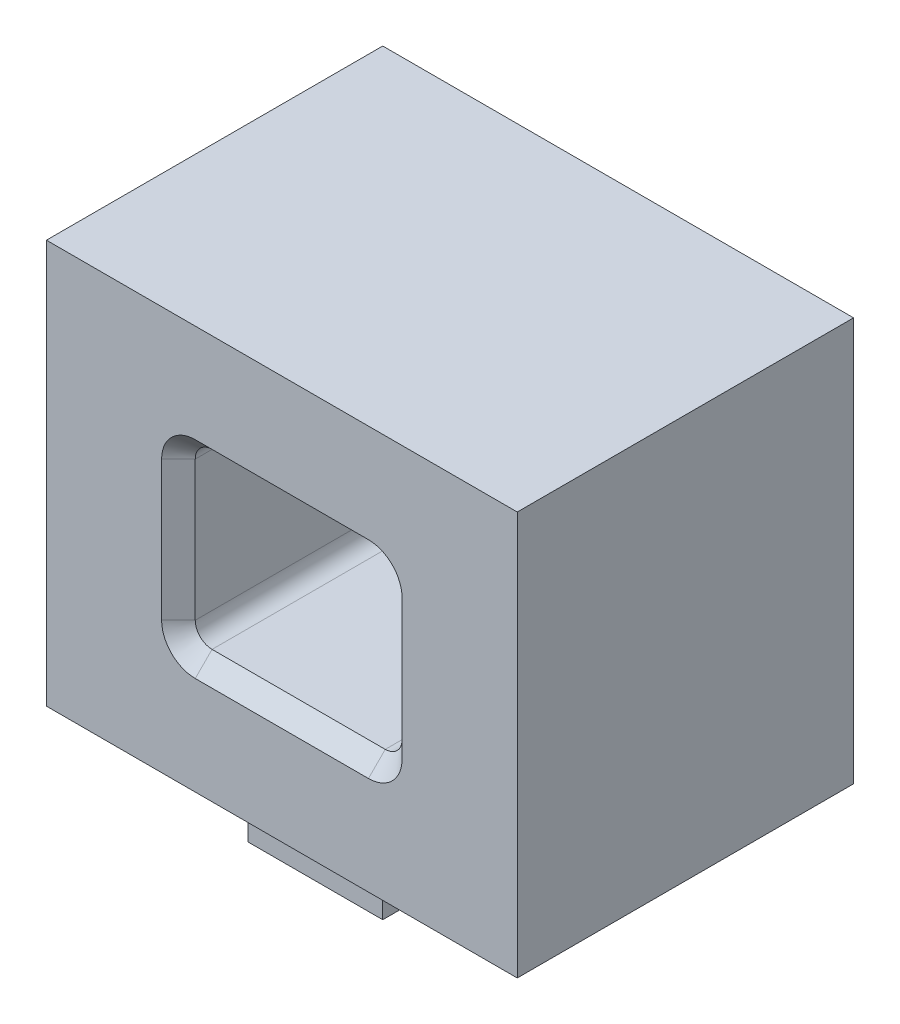
from build123d import *

# Parameters (mm, degrees)
SKETCH1_W           = 28
SKETCH1_H           = 24
BOSS_EXTRUDE1_DEPTH = 20
SKETCH2_W           = 12.3
SKETCH2_H           = 10.3
CUT_EXTRUDE1_DEPTH  = 15.3
SKETCH3_W           = 8
SKETCH3_H           = 6
SKETCH3_R           = 1.7
BOSS_EXTRUDE3_DEPTH = 3
FILLET1_R           = 1
CHAMFER1_SIZE       = 1
FILLET2_R           = 1


with BuildPart() as part:
    # Sketch1 → Boss-Extrude1 (new body)
    with BuildSketch(Plane.XY):
        Rectangle(SKETCH1_W, SKETCH1_H)
    extrude(amount=BOSS_EXTRUDE1_DEPTH)

    # Sketch2 → Cut-Extrude1 (cut)
    with BuildSketch(Plane.XY.offset(20)):
        Rectangle(SKETCH2_W, SKETCH2_H)
    extrude(amount=-CUT_EXTRUDE1_DEPTH, mode=Mode.SUBTRACT)

    # Sketch3 → Boss-Extrude3 (add)
    # profile 1 of 2: a face of its own
    with BuildSketch(Plane.XZ.offset(12)):
        with Locations((0, 5)):
            Rectangle(SKETCH3_W, SKETCH3_H)
        with Locations(Location((0, 5, 0), (0, 0, 90))):
            Circle(SKETCH3_R, mode=Mode.SUBTRACT)
    # profile 2 of 2: a face of its own
    with BuildSketch(Plane.XZ.offset(12)):
        with Locations((0, 15)):
            Rectangle(SKETCH3_W, SKETCH3_H)
        with Locations(Location((0, 15, 0), (0, 0, 270))):
            Circle(SKETCH3_R, mode=Mode.SUBTRACT)
    extrude(amount=BOSS_EXTRUDE3_DEPTH)

    # Fillet1
    fillet1_edges = [part.edges().sort_by_distance(p)[0] for p in [
        (-6.15, 5.15, 12.35),
        (6.15, 5.15, 12.35),
        (6.15, -5.15, 12.35),
        (-6.15, -5.15, 12.35),
    ]]
    fillet(fillet1_edges, radius=FILLET1_R)

    # Chamfer1
    chamfer1_edges = [part.edges().sort_by_distance(p)[0] for p in [
        (6.15, 0, 20),
        (0, -5.15, 20),
        (0, 5.15, 20),
        (-6.15, 0, 20),
        (5.857106781, -4.857106781, 20),
        (5.857106781, 4.857106781, 20),
        (-5.857106781, 4.857106781, 20),
        (-5.857106781, -4.857106781, 20),
    ]]
    chamfer(chamfer1_edges, length=CHAMFER1_SIZE)

    # Fillet2
    fillet2_edges = [part.edges().sort_by_distance(p)[0] for p in [
        (4, -12, 15),
        (0, -12, 18),
        (-4, -12, 15),
        (0, -12, 12),
        (-4, -12, 5),
        (0, -12, 2),
        (4, -12, 5),
        (0, -12, 8),
    ]]
    fillet(fillet2_edges, radius=FILLET2_R)


solid = part.part
